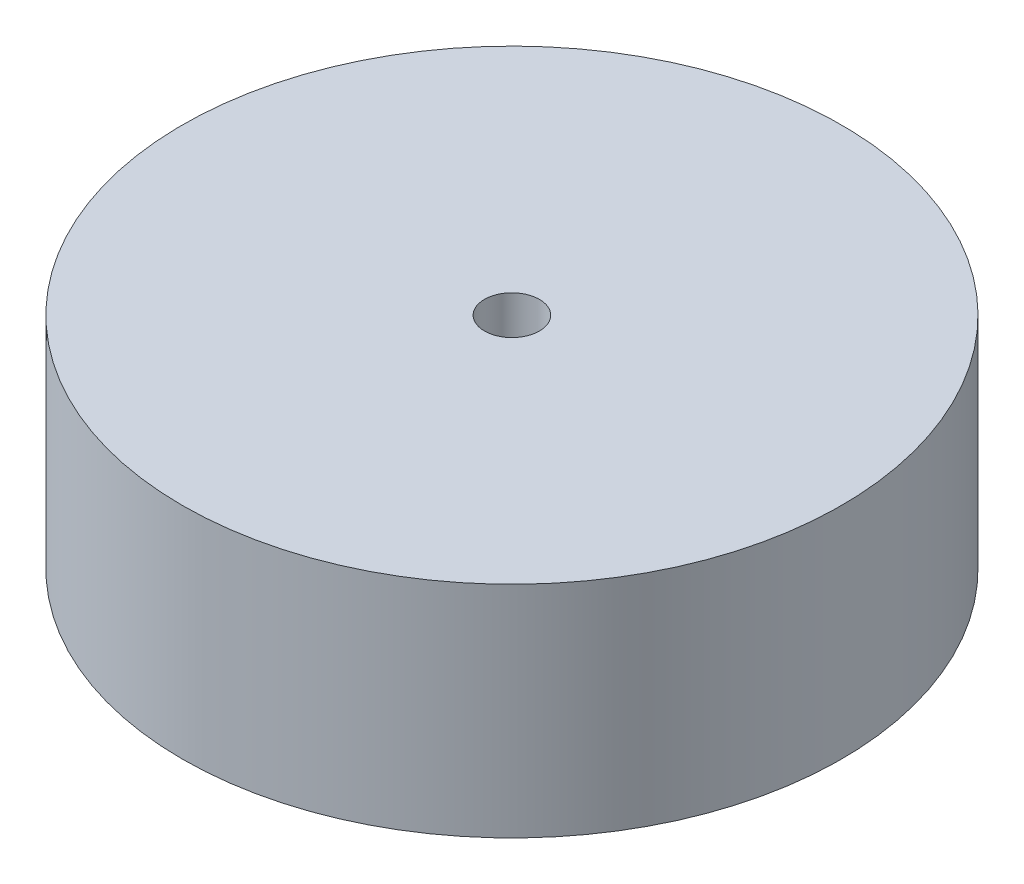
from build123d import *

# Parameters (mm, degrees)
SKETCH1_R           = 19.05
SKETCH1_R_2         = 1.5875
BOSS_EXTRUDE1_DEPTH = 12.7


with BuildPart() as part:
    # Sketch1 → Boss-Extrude1 (new body)
    with BuildSketch(Plane(origin=(0, 0, 0), x_dir=(1, 0, 0), z_dir=(0, 1, 0))):
        with Locations(Location((0, 0, 0), (0, 0, 270))):
            Circle(SKETCH1_R)
        with Locations(Location((0, 0, 0), (0, 0, 270))):
            Circle(SKETCH1_R_2, mode=Mode.SUBTRACT)
    extrude(amount=BOSS_EXTRUDE1_DEPTH)


solid = part.part
